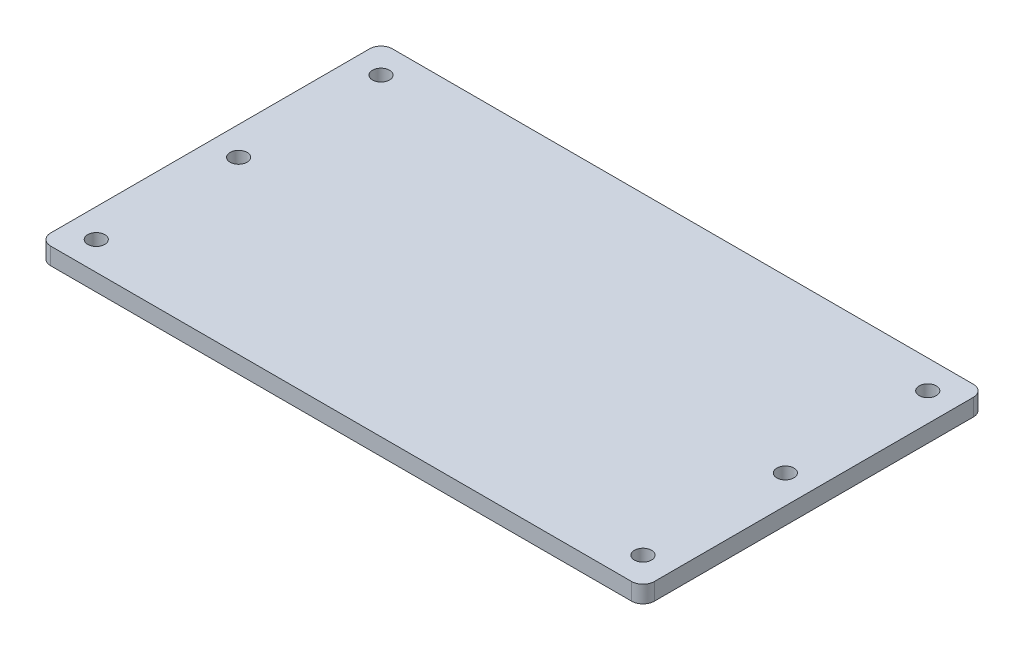
from build123d import *

# Parameters (mm, degrees)
SKETCH_1_W          = 106
SKETCH_1_H          = 60
EXTRUDE_1_DEPTH     = 3
SKETCH_2_R          = 1.5
CUT_EXTRUDE_1_DEPTH = 10
FILLET_1_R          = 2


with BuildPart() as part:
    # 草图1 → 凸台-拉伸1 (new body)
    with BuildSketch(Plane(origin=(0, 0, 0), x_dir=(1, 0, 0), z_dir=(0, 1, 0))):
        Rectangle(SKETCH_1_W, SKETCH_1_H)
    extrude(amount=EXTRUDE_1_DEPTH)

    # 草图2 → 切除-拉伸1 (cut)
    with BuildSketch(Plane(origin=(0, 3, 0), x_dir=(1, 0, 0), z_dir=(0, 1, 0))):
        with Locations(Location((-48, 25, 0), (0, 0, 270))):
            Circle(SKETCH_2_R)
        with Locations(Location((-48, 0, 0), (0, 0, 270))):
            Circle(SKETCH_2_R)
        with Locations(Location((-48, -25, 0), (0, 0, 270))):
            Circle(SKETCH_2_R)
        with Locations(Location((48, -25, 0), (0, 0, 270))):
            Circle(SKETCH_2_R)
        with Locations(Location((48, 0, 0), (0, 0, 270))):
            Circle(SKETCH_2_R)
        with Locations(Location((48, 25, 0), (0, 0, 270))):
            Circle(SKETCH_2_R)
    extrude(amount=-CUT_EXTRUDE_1_DEPTH, mode=Mode.SUBTRACT)

    # 圆角1
    fillet_1_edges = [part.edges().sort_by_distance(p)[0] for p in [
        (53, 1.5, 30),
        (-53, 1.5, 30),
        (-53, 1.5, -30),
        (53, 1.5, -30),
    ]]
    fillet(fillet_1_edges, radius=FILLET_1_R)


solid = part.part
